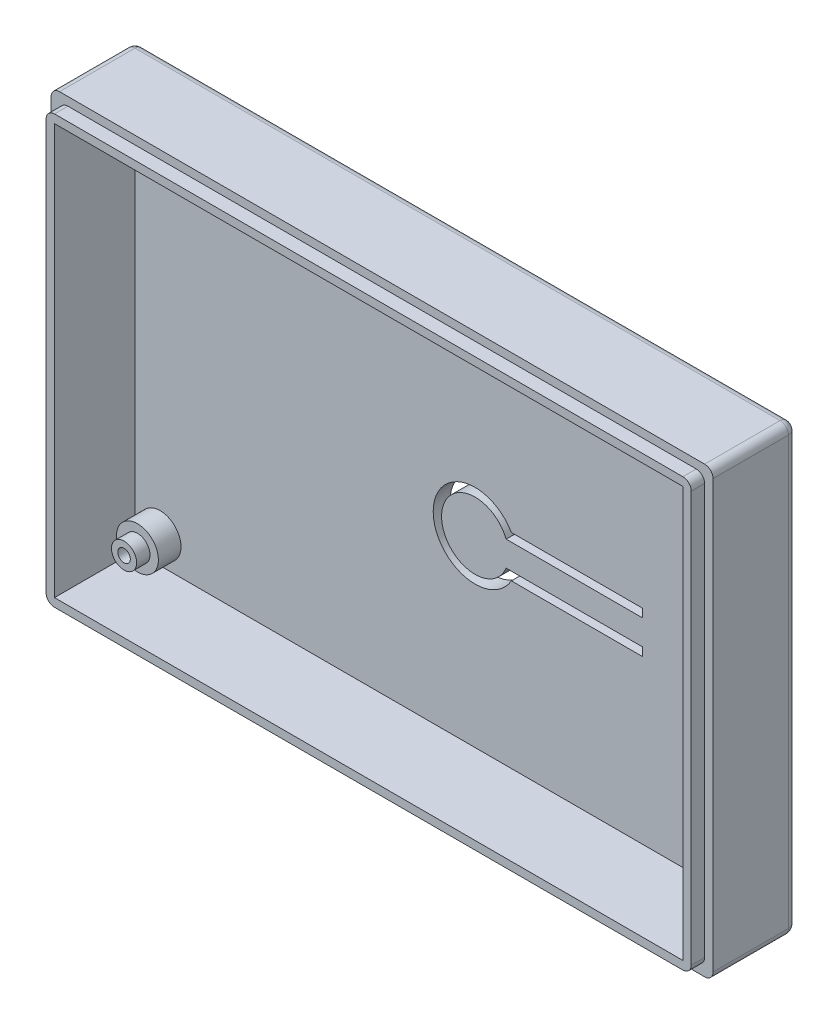
from build123d import *

# Parameters (mm, degrees)
SKETCH1_W           = 79
SKETCH1_H           = 53
BOSS_EXTRUDE1_DEPTH = 2
SKETCH2_R           = 2.5
BOSS_EXTRUDE2_DEPTH = 2.7
SKETCH3_R           = 1.5
BOSS_EXTRUDE3_DEPTH = 1.6
SKETCH5_R           = 0.75
CUT_EXTRUDE1_DEPTH  = 2
SKETCH6_W           = 79
SKETCH6_H           = 53
SKETCH6_W_2         = 75
SKETCH6_H_2         = 49
BOSS_EXTRUDE4_DEPTH = 8
SKETCH7_W           = 77
SKETCH7_H           = 51
SKETCH7_W_2         = 75
SKETCH7_H_2         = 49
BOSS_EXTRUDE5_DEPTH = 1.6
CUT_EXTRUDE2_DEPTH  = 2
FILLET1_R           = 1


with BuildPart() as part:
    # Sketch1 → Boss-Extrude1 (new body)
    with BuildSketch(Plane.XY):
        with Locations((39.5, 26.5)):
            Rectangle(SKETCH1_W, SKETCH1_H)
    extrude(amount=BOSS_EXTRUDE1_DEPTH)

    # Sketch2 → Boss-Extrude2 (add)
    with BuildSketch(Plane.XY.offset(2)):
        with Locations(Location((5, 47.8, 0), (0, 0, 180))):
            Circle(SKETCH2_R)
        with Locations(Location((74, 47.8, 0), (0, 0, 180))):
            Circle(SKETCH2_R)
        with Locations(Location((74, 5.2, 0), (0, 0, 180))):
            Circle(SKETCH2_R)
        with Locations(Location((5, 5.2, 0), (0, 0, 180))):
            Circle(SKETCH2_R)
    extrude(amount=BOSS_EXTRUDE2_DEPTH)

    # Sketch3 → Boss-Extrude3 (add)
    with BuildSketch(Plane.XY.offset(4.7)):
        with Locations((5, 47.8)):
            Circle(SKETCH3_R)
        with Locations((5, 5.2)):
            Circle(SKETCH3_R)
        with Locations((74, 47.8)):
            Circle(SKETCH3_R)
        with Locations((74, 5.2)):
            Circle(SKETCH3_R)
    extrude(amount=BOSS_EXTRUDE3_DEPTH)

    # Sketch5 → Cut-Extrude1 (cut)
    with BuildSketch(Plane.XY.offset(6.3)):
        with Locations((74, 5.2)):
            Circle(SKETCH5_R)
        with Locations((74, 47.8)):
            Circle(SKETCH5_R)
        with Locations((5, 47.8)):
            Circle(SKETCH5_R)
        with Locations((5, 5.2)):
            Circle(SKETCH5_R)
    extrude(amount=-CUT_EXTRUDE1_DEPTH, mode=Mode.SUBTRACT)

    # Sketch6 → Boss-Extrude4 (add)
    with BuildSketch(Plane.XY.offset(2)):
        with Locations((39.5, 26.5)):
            Rectangle(SKETCH6_W, SKETCH6_H)
        with Locations((39.5, 26.5)):
            Rectangle(SKETCH6_W_2, SKETCH6_H_2, mode=Mode.SUBTRACT)
    extrude(amount=BOSS_EXTRUDE4_DEPTH)

    # Sketch7 → Boss-Extrude5 (add)
    with BuildSketch(Plane.XY.offset(10)):
        with Locations((39.5, 26.5)):
            Rectangle(SKETCH7_W, SKETCH7_H)
        with Locations((39.5, 26.5)):
            Rectangle(SKETCH7_W_2, SKETCH7_H_2, mode=Mode.SUBTRACT)
    extrude(amount=BOSS_EXTRUDE5_DEPTH)

    # Sketch8 → Cut-Extrude2 (cut)
    with BuildSketch(Plane.XY.offset(2)):
        with BuildLine():
            Line((46.930127019, 21.4), (62.6, 21.4))
            Line((62.6, 21.4), (62.6, 22.4))
            Line((62.6, 22.4), (46.308099244, 22.4))
            ThreePointArc((46.308099244, 22.4), (38.6, 23.9), (46.308099244, 25.4))
            Line((46.308099244, 25.4), (62.6, 25.4))
            Line((62.6, 25.4), (62.6, 26.4))
            Line((62.6, 26.4), (46.930127019, 26.4))
            ThreePointArc((46.930127019, 26.4), (37.6, 23.9), (46.930127019, 21.4))
        make_face()
    extrude(amount=-CUT_EXTRUDE2_DEPTH, mode=Mode.SUBTRACT)

    # Fillet1
    fillet1_edges = [part.edges().sort_by_distance(p)[0] for p in [
        (39.5, 53, 0),
        (79, 26.5, 0),
        (39.5, 0, 0),
        (0, 26.5, 0),
        (0, 53, 5),
        (79, 53, 5),
        (79, 0, 5),
        (0, 0, 5),
        (1, 52, 10.8),
        (1, 1, 10.8),
        (78, 1, 10.8),
        (78, 52, 10.8),
    ]]
    fillet(fillet1_edges, radius=FILLET1_R)


solid = part.part
